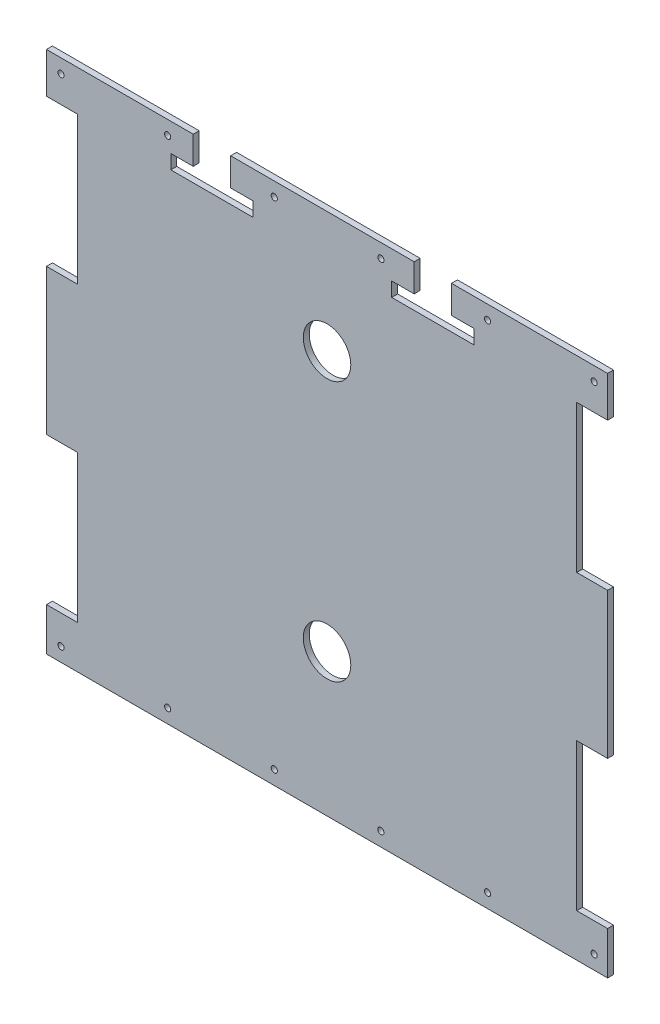
from build123d import *

# Parameters (mm, degrees)
SKETCH5_R           = 1.65
SKETCH5_R_2         = 12.7
BOSS_EXTRUDE1_DEPTH = 3.175


with BuildPart() as part:
    # Sketch5 → Boss-Extrude1 (new body)
    with BuildSketch(Plane.XY):
        Polygon((47.124604737, -7.452255775), (30.614604737, -7.452255775), (30.614604737, 71.287744225), (47.124604737, 71.287744225), (47.124604737, 149.14592508), (30.614604737, 149.14592508), (30.614604737, 227.88592508), (47.124604737, 227.88592508), (47.124604737, 249.558730102), (-36.302449898, 249.558730102), (-36.302449898, 234.650730102), (-24.302449898, 234.650730102), (-24.302449898, 227.030730102), (-36.302449898, 227.030730102), (-56.302449898, 227.030730102), (-68.302449898, 227.030730102), (-68.302449898, 234.650730102), (-56.302449898, 234.650730102), (-56.302449898, 249.558730102), (-154.402428268, 249.558730102), (-154.402428268, 234.650730102), (-142.402428268, 234.650730102), (-142.402428268, 227.030730102), (-154.402428268, 227.030730102), (-174.402428268, 227.030730102), (-186.402428268, 227.030730102), (-186.402428268, 234.650730102), (-174.402428268, 234.650730102), (-174.402428268, 249.558730102), (-252.849395263, 249.558730102), (-252.849395263, 227.88592508), (-236.339395263, 227.88592508), (-236.339395263, 149.14592508), (-252.849395263, 149.14592508), (-252.849395263, 71.287744225), (-236.339395263, 71.287744225), (-236.339395263, -7.452255775), (-252.849395263, -7.452255775), (-252.849395263, -30.349269898), (47.124604737, -30.349269898), align=None)
        with Locations((39.94351791, -22.890690042)):
            Circle(SKETCH5_R, mode=Mode.SUBTRACT)
        with Locations((-17.05648209, -22.890690042)):
            Circle(SKETCH5_R, mode=Mode.SUBTRACT)
        with Locations((-74.05648209, -22.890690042)):
            Circle(SKETCH5_R, mode=Mode.SUBTRACT)
        with Locations((-131.05648209, -22.890690042)):
            Circle(SKETCH5_R, mode=Mode.SUBTRACT)
        with Locations((-188.05648209, -22.890690042)):
            Circle(SKETCH5_R, mode=Mode.SUBTRACT)
        with Locations((-245.05648209, -22.890690042)):
            Circle(SKETCH5_R, mode=Mode.SUBTRACT)
        with Locations((39.94351791, 242.101620414)):
            Circle(SKETCH5_R, mode=Mode.SUBTRACT)
        with Locations((-17.05648209, 242.101620414)):
            Circle(SKETCH5_R, mode=Mode.SUBTRACT)
        with Locations((-74.05648209, 242.101620414)):
            Circle(SKETCH5_R, mode=Mode.SUBTRACT)
        with Locations((-131.05648209, 242.101620414)):
            Circle(SKETCH5_R, mode=Mode.SUBTRACT)
        with Locations((-188.05648209, 242.101620414)):
            Circle(SKETCH5_R, mode=Mode.SUBTRACT)
        with Locations((-245.05648209, 242.101620414)):
            Circle(SKETCH5_R, mode=Mode.SUBTRACT)
        with Locations((-102.862395263, 184.854342805)):
            Circle(SKETCH5_R_2, mode=Mode.SUBTRACT)
        with Locations((-102.862395263, 45.850730102)):
            Circle(SKETCH5_R_2, mode=Mode.SUBTRACT)
    extrude(amount=BOSS_EXTRUDE1_DEPTH)


solid = part.part
